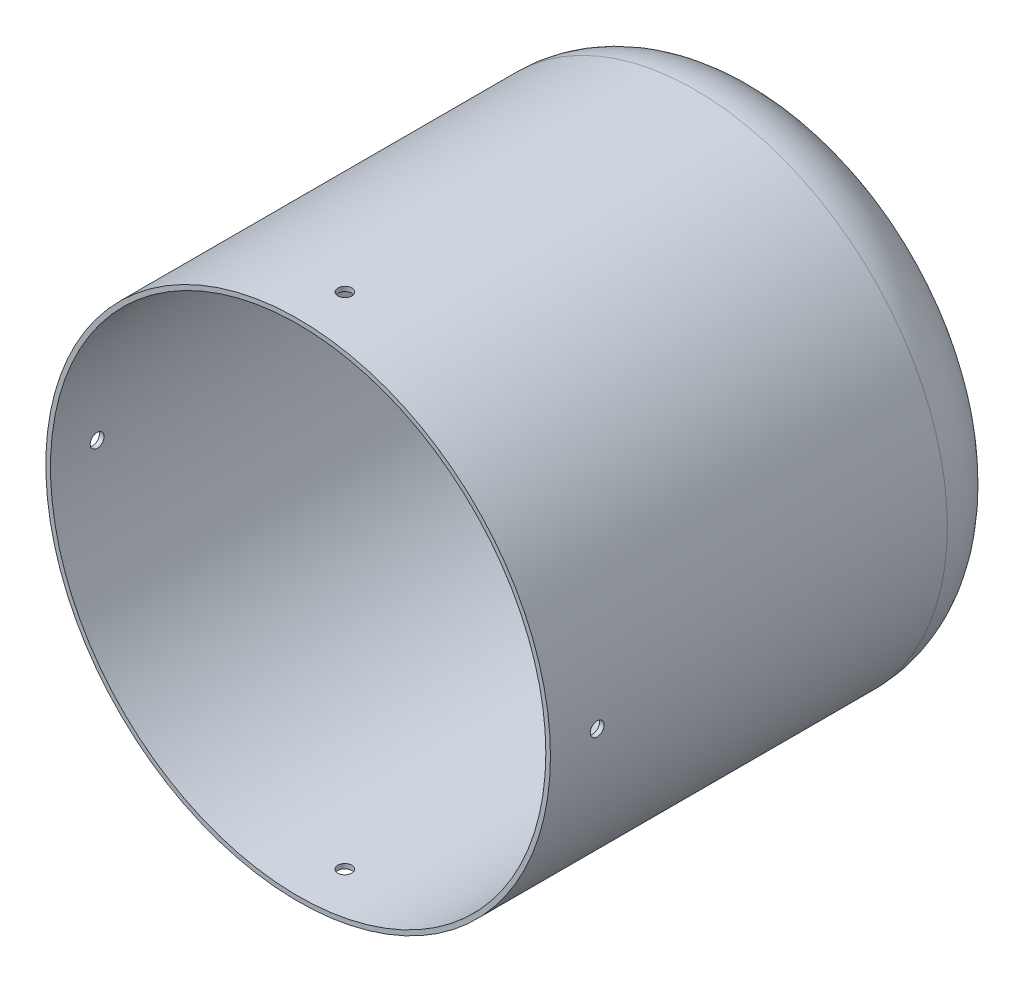
from build123d import *

# Parameters (mm, degrees)
ESQUISSE2_R             = 1.5
ENL_V_MAT_EXTRU_1_DEPTH = 139.855140344
CUT_EXTRUDE4_DEPTH      = 142.779758781
CUT_EXTRUDE4_DEPTH_BACK = 16.77
SKETCH6_R               = 54.5
SKETCH6_R_2             = 53.5
CUT_EXTRUDE5_DEPTH      = 136.957714014
CUT_EXTRUDE5_DEPTH_BACK = 136.957714014
SKETCH7_R               = 1.5
CUT_EXTRUDE6_DEPTH      = 136.957714098
CUT_EXTRUDE6_DEPTH_BACK = 136.957714098
SKETCH8_R               = 1.5


with BuildPart() as part:
    # Esquisse1 → Base-Révolution (revolve)
    with BuildSketch(Plane(origin=(0, 0, 0), x_dir=(0, 0, -1), z_dir=(1, 0, 0)), mode=Mode.PRIVATE) as base_r_volution_sk:
        with BuildLine():
            Line((112, 34.4), (112, 42.5))
            Line((112, 42.5), (111, 42.5))
            ThreePointArc((111, 42.5), (105.301147892, 51.14939936), (95.5, 54.5))
            Line((95.5, 54.5), (-7, 54.5))
            Line((-7, 54.5), (-7, 53.5))
            Line((-7, 53.5), (93.35, 53.5))
            ThreePointArc((93.35, 53.5), (102.082768748, 49.882768748), (105.7, 41.15))
            Line((105.7, 41.15), (108.5, 41.15))
            Line((108.5, 41.15), (108.5, 35.5))
            Line((108.5, 35.5), (110, 35.5))
            Line((110, 35.5), (110, 34.4))
            Line((110, 34.4), (112, 34.4))
        make_face()
    revolve(base_r_volution_sk.sketch.rotate(Axis((0, 0, 74.926735219), (0, 0, -1)), 90), axis=Axis((0, 0, 74.926735219), (0, 0, -1)))

    # Esquisse2 → Enlèv. mat.-Extru.1 (cut, through all)
    with BuildSketch(Plane.XY.offset(-108.5)):
        with Locations((0, 38)):
            Circle(ESQUISSE2_R)
        with Locations((19, 32.908965344)):
            Circle(ESQUISSE2_R)
        with Locations((32.908965344, 19)):
            Circle(ESQUISSE2_R)
        with Locations((38, 0)):
            Circle(ESQUISSE2_R)
        with Locations((32.908965344, -19)):
            Circle(ESQUISSE2_R)
        with Locations((19, -32.908965344)):
            Circle(ESQUISSE2_R)
        with Locations((0, -38)):
            Circle(ESQUISSE2_R)
        with Locations((-19, -32.908965344)):
            Circle(ESQUISSE2_R)
        with Locations((-32.908965344, -19)):
            Circle(ESQUISSE2_R)
        with Locations((-38, 0)):
            Circle(ESQUISSE2_R)
        with Locations((-32.908965344, 19)):
            Circle(ESQUISSE2_R)
        with Locations((-19, 32.908965344)):
            Circle(ESQUISSE2_R)
    extrude(amount=-ENL_V_MAT_EXTRU_1_DEPTH, mode=Mode.SUBTRACT)

    # Sketch6 → Cut-Extrude4 (cut, two sides: drawn at the far end of the back side and taken through both)
    with BuildSketch(Plane.XY.offset(7).offset(-CUT_EXTRUDE4_DEPTH_BACK)):
        Circle(SKETCH6_R)
        Circle(SKETCH6_R_2, mode=Mode.SUBTRACT)
    extrude(amount=CUT_EXTRUDE4_DEPTH + CUT_EXTRUDE4_DEPTH_BACK, mode=Mode.SUBTRACT)

    # Sketch7 → Cut-Extrude5 (cut, two sides: drawn at the far end of the back side and taken through both)
    with BuildSketch(Plane(origin=(0, 0, 0), x_dir=(1, 0, 0), z_dir=(0, 1, 0)).offset(-CUT_EXTRUDE5_DEPTH_BACK)):
        with Locations(Location((0, 19.86, 0), (0, 0, 270))):
            Circle(SKETCH7_R)
    extrude(amount=CUT_EXTRUDE5_DEPTH + CUT_EXTRUDE5_DEPTH_BACK, mode=Mode.SUBTRACT)

    # Sketch8 → Cut-Extrude6 (cut, two sides: drawn at the far end of the back side and taken through both)
    with BuildSketch(Plane(origin=(0, 0, 0), x_dir=(0, 0, -1), z_dir=(1, 0, 0)).offset(-CUT_EXTRUDE6_DEPTH_BACK)):
        with Locations((19.86, 0)):
            Circle(SKETCH8_R)
    extrude(amount=CUT_EXTRUDE6_DEPTH + CUT_EXTRUDE6_DEPTH_BACK, mode=Mode.SUBTRACT)


solid = part.part
